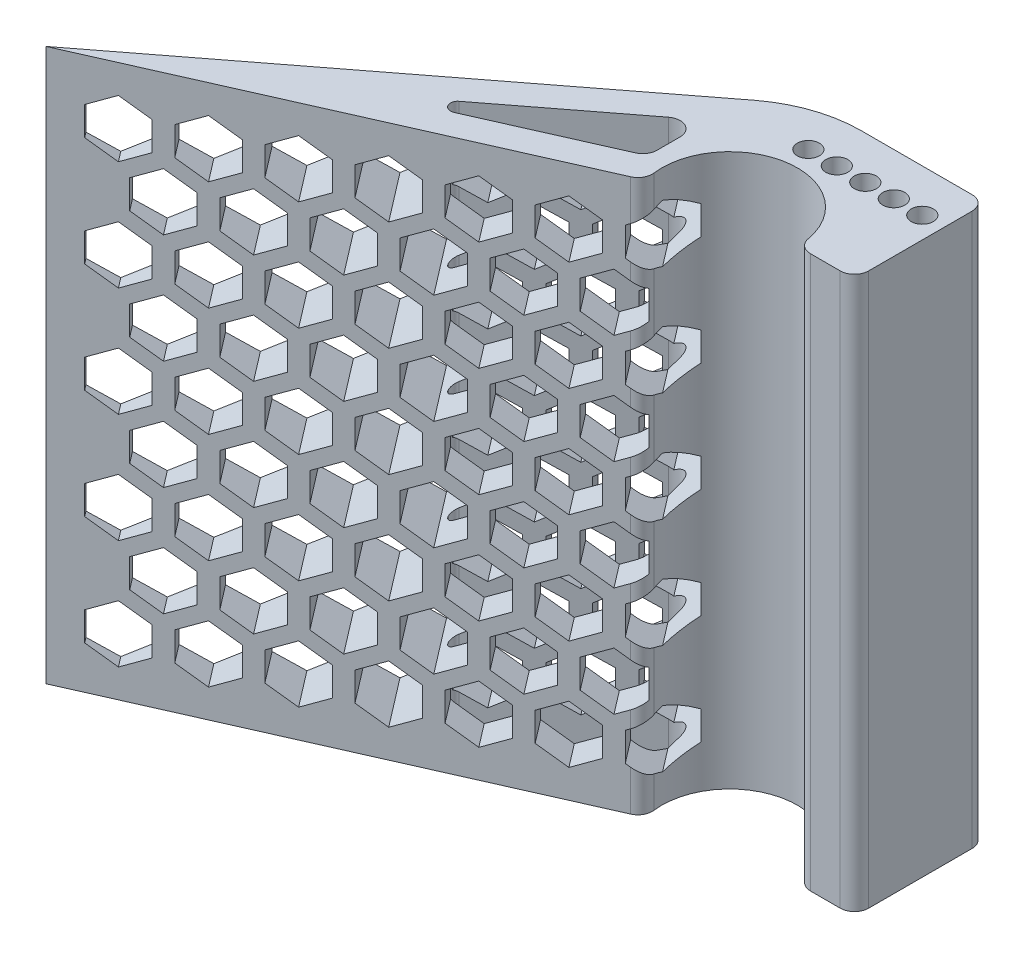
from build123d import *
from OCP.BRepFilletAPI import BRepFilletAPI_MakeFillet

# Parameters (mm, degrees)
SKETCH1_R           = 2.1
BOSS_EXTRUDE1_DEPTH = 155
FILLET1_R1          = 4
FILLET1_R2          = 2
SKETCH2_R           = 3.1
CUT_EXTRUDE1_DEPTH  = 4.7
CUT_EXTRUDE2_START  = -4.7
SKETCH3_R           = 3.1
CUT_EXTRUDE2_DEPTH  = 4.7
CUT_EXTRUDE3_DEPTH  = 37


with BuildPart() as part:
    # Sketch1 → Boss-Extrude1 (new body)
    with BuildSketch(Plane(origin=(0, 0, 0), x_dir=(1, 0, 0), z_dir=(0, 1, 0))):
        with BuildLine():
            Line((-9.914568138, 68.407296242), (-9.914568138, 85.5))
            Line((-9.914568138, 85.5), (-44.964568125, 85.5))
            ThreePointArc((-44.964568125, 85.5), (-56.873670454, 83.533799248), (-67.518743745, 77.84388903))
            Line((-67.518743745, 77.84388903), (-180.014510469, -8.47714881))
            Line((-180.014510469, -8.47714881), (-63.281704923, 43.217647212))
            ThreePointArc((-63.281704923, 43.217647212), (-47.60628178, 67.316659256), (-25.914568138, 48.45))
            Line((-25.914568138, 48.45), (-9.914568138, 48.45))
            Line((-9.914568138, 48.45), (-9.914568138, 68.407296242))
        make_face()
        Polygon((-68.964568125, 49.450365597), (-121.973490912, 25.975512594), (-68.964568125, 66.650689652), align=None, mode=Mode.SUBTRACT)
        with Locations((-47.914568138, 73.5)):
            Circle(SKETCH1_R, mode=Mode.SUBTRACT)
        with Locations((-39.914568138, 73.5)):
            Circle(SKETCH1_R, mode=Mode.SUBTRACT)
        with Locations((-31.914568138, 73.5)):
            Circle(SKETCH1_R, mode=Mode.SUBTRACT)
        with Locations((-23.914568138, 73.5)):
            Circle(SKETCH1_R, mode=Mode.SUBTRACT)
        with Locations((-15.914568138, 73.5)):
            Circle(SKETCH1_R, mode=Mode.SUBTRACT)
    extrude(amount=BOSS_EXTRUDE1_DEPTH)

    # Fillet1: one fillet with a radius per group of edges: ONE call of the kernel's fillet builder (fillet() takes one radius for all edges)
    fillet1_edges_1 = [part.edges().sort_by_distance(p)[0] for p in [
        (-25.914568138, 77.5, -48.45),
        (-9.914568138, 77.5, -48.45),
        (-9.914568138, 77.5, -85.5),
        (-63.281704923, 77.5, -43.217647212),
        (-68.964568125, 77.5, -66.650689652),
        (-68.964568125, 77.5, -49.450365597),
    ]]
    fillet1_edges_2 = [part.edges().sort_by_distance(p)[0] for p in [
        (-121.973490912, 77.5, -25.975512594),
    ]]
    fillet1 = BRepFilletAPI_MakeFillet(part.part.solid().wrapped)
    for e in fillet1_edges_1:
        fillet1.Add(FILLET1_R1, e.wrapped)
    for e in fillet1_edges_2:
        fillet1.Add(FILLET1_R2, e.wrapped)
    add(Compound.cast(fillet1.Shape()), mode=Mode.REPLACE)

    # Sketch2 → Cut-Extrude1 (cut)
    with BuildSketch(Plane(origin=(0, 155, 0), x_dir=(1, 0, 0), z_dir=(0, 1, 0))):
        with Locations((-47.914568138, 73.5)):
            Circle(SKETCH2_R)
        with Locations((-15.914568138, 73.5)):
            Circle(SKETCH2_R)
        with Locations((-31.914568138, 73.5)):
            Circle(SKETCH2_R)
        with Locations((-39.914568138, 73.5)):
            Circle(SKETCH2_R)
        with Locations((-23.914568138, 73.5)):
            Circle(SKETCH2_R)
    extrude(amount=-CUT_EXTRUDE1_DEPTH, mode=Mode.SUBTRACT)

    # Sketch3 → Cut-Extrude2 (cut)
    with BuildSketch(Plane.XZ.offset(CUT_EXTRUDE2_START)):
        with Locations((-47.914568138, -73.5)):
            Circle(SKETCH3_R)
        with Locations((-15.914568138, -73.5)):
            Circle(SKETCH3_R)
        with Locations((-39.914568138, -73.5)):
            Circle(SKETCH3_R)
        with Locations((-31.914568138, -73.5)):
            Circle(SKETCH3_R)
        with Locations((-23.914568138, -73.5)):
            Circle(SKETCH3_R)
    extrude(amount=CUT_EXTRUDE2_DEPTH, mode=Mode.SUBTRACT)

    # Sketch4 → Cut-Extrude3 (cut)
    with BuildSketch(Plane(origin=(-62.617514898, 0, -81.604734199), x_dir=(-0.7933533402912337, 0, 0.6087614290087227), z_dir=(-0.6087614290087225, 0, -0.7933533402912336))):
        Polygon((39.798098913, 147), (32.817198841, 142.969575464), (32.817198841, 134.908726393), (39.798098913, 130.878301857), (46.778998985, 134.908726393), (46.778998985, 142.969575464), align=None)
        Polygon((21.158763829, 147), (14.177863757, 142.969575464), (14.177863757, 134.908726393), (21.158763829, 130.878301857), (28.139663901, 134.908726393), (28.139663901, 142.969575464), align=None)
        Polygon((58.437433997, 147), (51.456533925, 142.969575464), (51.456533925, 134.908726393), (58.437433997, 130.878301857), (65.418334069, 134.908726393), (65.418334069, 142.969575464), align=None)
        Polygon((77.076769081, 147), (70.095869009, 142.969575464), (70.095869009, 134.908726393), (77.076769081, 130.878301857), (84.057669153, 134.908726393), (84.057669153, 142.969575464), align=None)
        Polygon((95.716104165, 147), (88.735204093, 142.969575464), (88.735204093, 134.908726393), (95.716104165, 130.878301857), (102.697004237, 134.908726393), (102.697004237, 142.969575464), align=None)
        Polygon((114.355439249, 147), (107.374539177, 142.969575464), (107.374539177, 134.908726393), (114.355439249, 130.878301857), (121.336339321, 134.908726393), (121.336339321, 142.969575464), align=None)
        Polygon((132.994774333, 147), (126.013874261, 142.969575464), (126.013874261, 134.908726393), (132.994774333, 130.878301857), (139.975674405, 134.908726393), (139.975674405, 142.969575464), align=None)
        Polygon((67.757101539, 131.640212268), (60.776201467, 127.609787732), (60.776201467, 119.548938661), (67.757101539, 115.518514125), (74.738001611, 119.548938661), (74.738001611, 127.609787732), align=None)
        Polygon((30.478431371, 131.640212268), (23.497531299, 127.609787732), (23.497531299, 119.548938661), (30.478431371, 115.518514125), (37.459331443, 119.548938661), (37.459331443, 127.609787732), align=None)
        Polygon((49.117766455, 131.640212268), (42.136866383, 127.609787732), (42.136866383, 119.548938661), (49.117766455, 115.518514125), (56.098666527, 119.548938661), (56.098666527, 127.609787732), align=None)
        Polygon((86.396436623, 131.640212268), (79.415536551, 127.609787732), (79.415536551, 119.548938661), (86.396436623, 115.518514125), (93.377336695, 119.548938661), (93.377336695, 127.609787732), align=None)
        Polygon((105.035771707, 131.640212268), (98.054871635, 127.609787732), (98.054871635, 119.548938661), (105.035771707, 115.518514125), (112.016671779, 119.548938661), (112.016671779, 127.609787732), align=None)
        Polygon((123.675106791, 131.640212268), (116.694206719, 127.609787732), (116.694206719, 119.548938661), (123.675106791, 115.518514125), (130.656006863, 119.548938661), (130.656006863, 127.609787732), align=None)
        Polygon((39.798098913, 116.280424536), (32.817198841, 112.25), (32.817198841, 104.189150929), (39.798098913, 100.158726393), (46.778998985, 104.189150929), (46.778998985, 112.25), align=None)
        Polygon((21.158763829, 116.280424536), (14.177863757, 112.25), (14.177863757, 104.189150929), (21.158763829, 100.158726393), (28.139663901, 104.189150929), (28.139663901, 112.25), align=None)
        Polygon((58.437433997, 116.280424536), (51.456533925, 112.25), (51.456533925, 104.189150929), (58.437433997, 100.158726393), (65.418334069, 104.189150929), (65.418334069, 112.25), align=None)
        Polygon((77.076769081, 116.280424536), (70.095869009, 112.25), (70.095869009, 104.189150929), (77.076769081, 100.158726393), (84.057669153, 104.189150929), (84.057669153, 112.25), align=None)
        Polygon((95.716104165, 116.280424536), (88.735204093, 112.25), (88.735204093, 104.189150929), (95.716104165, 100.158726393), (102.697004237, 104.189150929), (102.697004237, 112.25), align=None)
        Polygon((114.355439249, 116.280424536), (107.374539177, 112.25), (107.374539177, 104.189150929), (114.355439249, 100.158726393), (121.336339321, 104.189150929), (121.336339321, 112.25), align=None)
        Polygon((132.994774333, 116.280424536), (126.013874261, 112.25), (126.013874261, 104.189150929), (132.994774333, 100.158726393), (139.975674405, 104.189150929), (139.975674405, 112.25), align=None)
        Polygon((67.757101539, 100.920636804), (60.776201467, 96.890212268), (60.776201467, 88.829363196), (67.757101539, 84.798938661), (74.738001611, 88.829363196), (74.738001611, 96.890212268), align=None)
        Polygon((30.478431371, 100.920636804), (23.497531299, 96.890212268), (23.497531299, 88.829363196), (30.478431371, 84.798938661), (37.459331443, 88.829363196), (37.459331443, 96.890212268), align=None)
        Polygon((49.117766455, 100.920636804), (42.136866383, 96.890212268), (42.136866383, 88.829363196), (49.117766455, 84.798938661), (56.098666527, 88.829363196), (56.098666527, 96.890212268), align=None)
        Polygon((86.396436623, 100.920636804), (79.415536551, 96.890212268), (79.415536551, 88.829363196), (86.396436623, 84.798938661), (93.377336695, 88.829363196), (93.377336695, 96.890212268), align=None)
        Polygon((105.035771707, 100.920636804), (98.054871635, 96.890212268), (98.054871635, 88.829363196), (105.035771707, 84.798938661), (112.016671779, 88.829363196), (112.016671779, 96.890212268), align=None)
        Polygon((123.675106791, 100.920636804), (116.694206719, 96.890212268), (116.694206719, 88.829363196), (123.675106791, 84.798938661), (130.656006863, 88.829363196), (130.656006863, 96.890212268), align=None)
        Polygon((39.798098913, 85.560849071), (32.817198841, 81.530424536), (32.817198841, 73.469575464), (39.798098913, 69.439150929), (46.778998985, 73.469575464), (46.778998985, 81.530424536), align=None)
        Polygon((21.158763829, 85.560849071), (14.177863757, 81.530424536), (14.177863757, 73.469575464), (21.158763829, 69.439150929), (28.139663901, 73.469575464), (28.139663901, 81.530424536), align=None)
        Polygon((58.437433997, 85.560849071), (51.456533925, 81.530424536), (51.456533925, 73.469575464), (58.437433997, 69.439150929), (65.418334069, 73.469575464), (65.418334069, 81.530424536), align=None)
        Polygon((77.076769081, 85.560849071), (70.095869009, 81.530424536), (70.095869009, 73.469575464), (77.076769081, 69.439150929), (84.057669153, 73.469575464), (84.057669153, 81.530424536), align=None)
        Polygon((95.716104165, 85.560849071), (88.735204093, 81.530424536), (88.735204093, 73.469575464), (95.716104165, 69.439150929), (102.697004237, 73.469575464), (102.697004237, 81.530424536), align=None)
        Polygon((114.355439249, 85.560849071), (107.374539177, 81.530424536), (107.374539177, 73.469575464), (114.355439249, 69.439150929), (121.336339321, 73.469575464), (121.336339321, 81.530424536), align=None)
        Polygon((132.994774333, 85.560849071), (126.013874261, 81.530424536), (126.013874261, 73.469575464), (132.994774333, 69.439150929), (139.975674405, 73.469575464), (139.975674405, 81.530424536), align=None)
        Polygon((67.757101539, 70.201061339), (60.776201467, 66.170636804), (60.776201467, 58.109787732), (67.757101539, 54.079363196), (74.738001611, 58.109787732), (74.738001611, 66.170636804), align=None)
        Polygon((30.478431371, 70.201061339), (23.497531299, 66.170636804), (23.497531299, 58.109787732), (30.478431371, 54.079363196), (37.459331443, 58.109787732), (37.459331443, 66.170636804), align=None)
        Polygon((49.117766455, 70.201061339), (42.136866383, 66.170636804), (42.136866383, 58.109787732), (49.117766455, 54.079363196), (56.098666527, 58.109787732), (56.098666527, 66.170636804), align=None)
        Polygon((86.396436623, 70.201061339), (79.415536551, 66.170636804), (79.415536551, 58.109787732), (86.396436623, 54.079363196), (93.377336695, 58.109787732), (93.377336695, 66.170636804), align=None)
        Polygon((105.035771707, 70.201061339), (98.054871635, 66.170636804), (98.054871635, 58.109787732), (105.035771707, 54.079363196), (112.016671779, 58.109787732), (112.016671779, 66.170636804), align=None)
        Polygon((123.675106791, 70.201061339), (116.694206719, 66.170636804), (116.694206719, 58.109787732), (123.675106791, 54.079363196), (130.656006863, 58.109787732), (130.656006863, 66.170636804), align=None)
        Polygon((39.798098913, 54.841273607), (32.817198841, 50.810849071), (32.817198841, 42.75), (39.798098913, 38.719575464), (46.778998985, 42.75), (46.778998985, 50.810849071), align=None)
        Polygon((21.158763829, 54.841273607), (14.177863757, 50.810849071), (14.177863757, 42.75), (21.158763829, 38.719575464), (28.139663901, 42.75), (28.139663901, 50.810849071), align=None)
        Polygon((58.437433997, 54.841273607), (51.456533925, 50.810849071), (51.456533925, 42.75), (58.437433997, 38.719575464), (65.418334069, 42.75), (65.418334069, 50.810849071), align=None)
        Polygon((77.076769081, 54.841273607), (70.095869009, 50.810849071), (70.095869009, 42.75), (77.076769081, 38.719575464), (84.057669153, 42.75), (84.057669153, 50.810849071), align=None)
        Polygon((95.716104165, 54.841273607), (88.735204093, 50.810849071), (88.735204093, 42.75), (95.716104165, 38.719575464), (102.697004237, 42.75), (102.697004237, 50.810849071), align=None)
        Polygon((114.355439249, 54.841273607), (107.374539177, 50.810849071), (107.374539177, 42.75), (114.355439249, 38.719575464), (121.336339321, 42.75), (121.336339321, 50.810849071), align=None)
        Polygon((132.994774333, 54.841273607), (126.013874261, 50.810849071), (126.013874261, 42.75), (132.994774333, 38.719575464), (139.975674405, 42.75), (139.975674405, 50.810849071), align=None)
        Polygon((67.757101539, 39.481485875), (60.776201467, 35.451061339), (60.776201467, 27.390212268), (67.757101539, 23.359787732), (74.738001611, 27.390212268), (74.738001611, 35.451061339), align=None)
        Polygon((30.478431371, 39.481485875), (23.497531299, 35.451061339), (23.497531299, 27.390212268), (30.478431371, 23.359787732), (37.459331443, 27.390212268), (37.459331443, 35.451061339), align=None)
        Polygon((49.117766455, 39.481485875), (42.136866383, 35.451061339), (42.136866383, 27.390212268), (49.117766455, 23.359787732), (56.098666527, 27.390212268), (56.098666527, 35.451061339), align=None)
        Polygon((86.396436623, 39.481485875), (79.415536551, 35.451061339), (79.415536551, 27.390212268), (86.396436623, 23.359787732), (93.377336695, 27.390212268), (93.377336695, 35.451061339), align=None)
        Polygon((105.035771707, 39.481485875), (98.054871635, 35.451061339), (98.054871635, 27.390212268), (105.035771707, 23.359787732), (112.016671779, 27.390212268), (112.016671779, 35.451061339), align=None)
        Polygon((123.675106791, 39.481485875), (116.694206719, 35.451061339), (116.694206719, 27.390212268), (123.675106791, 23.359787732), (130.656006863, 27.390212268), (130.656006863, 35.451061339), align=None)
        Polygon((21.158763829, 24.121698143), (14.177863757, 20.091273607), (14.177863757, 12.030424536), (21.158763829, 8), (28.139663901, 12.030424536), (28.139663901, 20.091273607), align=None)
        Polygon((39.798098913, 24.121698143), (32.817198841, 20.091273607), (32.817198841, 12.030424536), (39.798098913, 8), (46.778998985, 12.030424536), (46.778998985, 20.091273607), align=None)
        Polygon((58.437433997, 24.121698143), (51.456533925, 20.091273607), (51.456533925, 12.030424536), (58.437433997, 8), (65.418334069, 12.030424536), (65.418334069, 20.091273607), align=None)
        Polygon((77.076769081, 24.121698143), (70.095869009, 20.091273607), (70.095869009, 12.030424536), (77.076769081, 8), (84.057669153, 12.030424536), (84.057669153, 20.091273607), align=None)
        Polygon((95.716104165, 24.121698143), (88.735204093, 20.091273607), (88.735204093, 12.030424536), (95.716104165, 8), (102.697004237, 12.030424536), (102.697004237, 20.091273607), align=None)
        Polygon((114.355439249, 24.121698143), (107.374539177, 20.091273607), (107.374539177, 12.030424536), (114.355439249, 8), (121.336339321, 12.030424536), (121.336339321, 20.091273607), align=None)
        Polygon((132.994774333, 24.121698143), (126.013874261, 20.091273607), (126.013874261, 12.030424536), (132.994774333, 8), (139.975674405, 12.030424536), (139.975674405, 20.091273607), align=None)
    extrude(amount=-CUT_EXTRUDE3_DEPTH, mode=Mode.SUBTRACT)


solid = part.part
